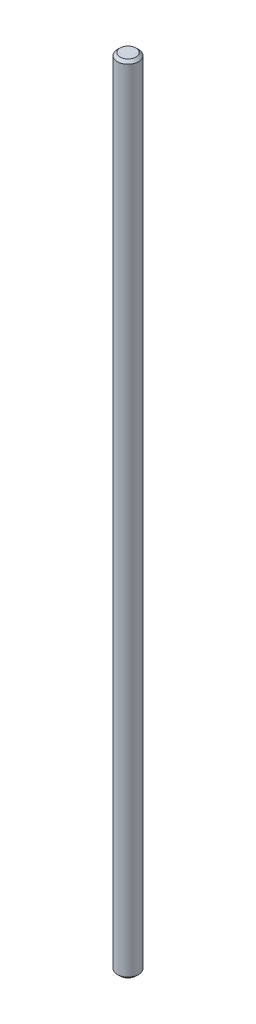
from build123d import *

# Parameters (mm, degrees)
SKETCH_1_R      = 4
EXTRUDE_1_DEPTH = 300
CHAMFER_1_SIZE  = 1


with BuildPart() as part:
    # 草图1 → 凸台-拉伸1 (new body)
    with BuildSketch(Plane(origin=(0, 0, 0), x_dir=(1, 0, 0), z_dir=(0, 1, 0))):
        with Locations(Location((0, 0, 0), (0, 0, 270))):
            Circle(SKETCH_1_R)
    extrude(amount=EXTRUDE_1_DEPTH)

    # 倒角1
    chamfer_1_edges = [part.edges().sort_by_distance(p)[0] for p in [
        (0, 0, -4),
        (0, 300, -4),
    ]]
    chamfer(chamfer_1_edges, length=CHAMFER_1_SIZE)


solid = part.part
